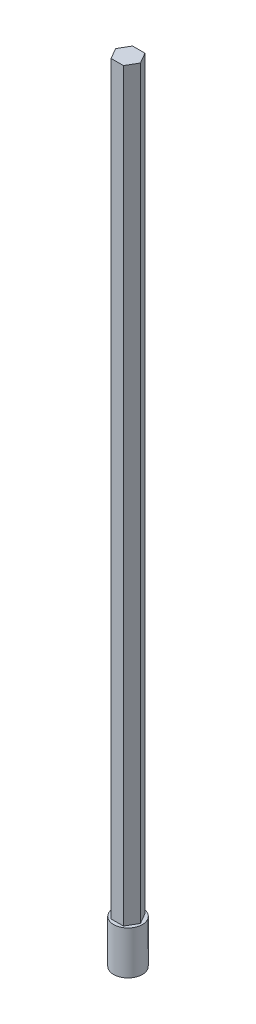
from build123d import *

# Parameters (mm, degrees)
SALIENTE_EXTRUIR1_DEPTH = 11000
CROQUIS2_R              = 200
SALIENTE_EXTRUIR2_DEPTH = 604


with BuildPart() as part:
    # Croquis1 → Saliente-Extruir1 (new body)
    with BuildSketch(Plane(origin=(0, 0, 0), x_dir=(1, 0, 0), z_dir=(0, 1, 0))):
        Polygon((173.205080757, 0), (86.602540378, 150), (-86.602540378, 150), (-173.205080757, 0), (-86.602540378, -150), (86.602540378, -150), align=None)
    extrude(amount=SALIENTE_EXTRUIR1_DEPTH)

    # Croquis2 → Saliente-Extruir2 (add)
    with BuildSketch(Plane.XZ):
        with Locations(Location((0, 0, 0), (0, 0, 270))):
            Circle(CROQUIS2_R)
    extrude(amount=-SALIENTE_EXTRUIR2_DEPTH)


solid = part.part
